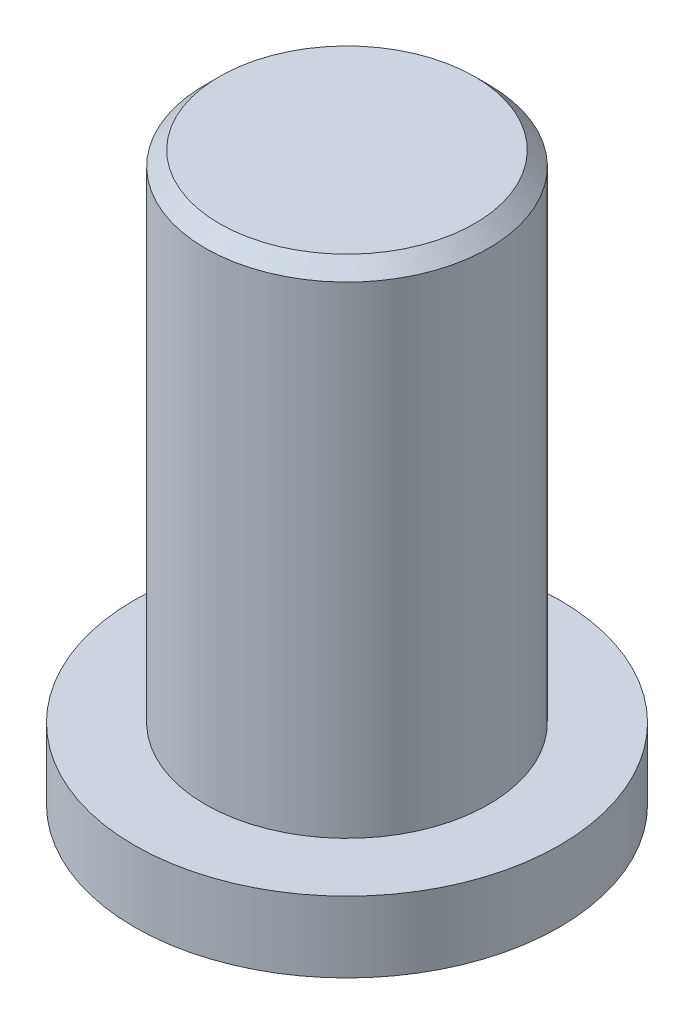
from build123d import *

# Parameters (mm, degrees)
SKETCH1_R           = 15
BOSS_EXTRUDE1_DEPTH = 5
SKETCH2_R           = 10
BOSS_EXTRUDE2_DEPTH = 35
CHAMFER1_SIZE       = 1


with BuildPart() as part:
    # Sketch1 → Boss-Extrude1 (new body)
    with BuildSketch(Plane(origin=(0, 0, 0), x_dir=(1, 0, 0), z_dir=(0, 1, 0))):
        with Locations(Location((0, 0, 0), (0, 0, 270))):
            Circle(SKETCH1_R)
    extrude(amount=BOSS_EXTRUDE1_DEPTH)

    # Sketch2 → Boss-Extrude2 (add)
    with BuildSketch(Plane(origin=(0, 5, 0), x_dir=(1, 0, 0), z_dir=(0, 1, 0))):
        with Locations(Location((0, 0, 0), (0, 0, 270))):
            Circle(SKETCH2_R)
    extrude(amount=BOSS_EXTRUDE2_DEPTH)

    # Chamfer1
    chamfer1_edges = [part.edges().sort_by_distance(p)[0] for p in [
        (0, 40, -10),
    ]]
    chamfer(chamfer1_edges, length=CHAMFER1_SIZE)


solid = part.part
